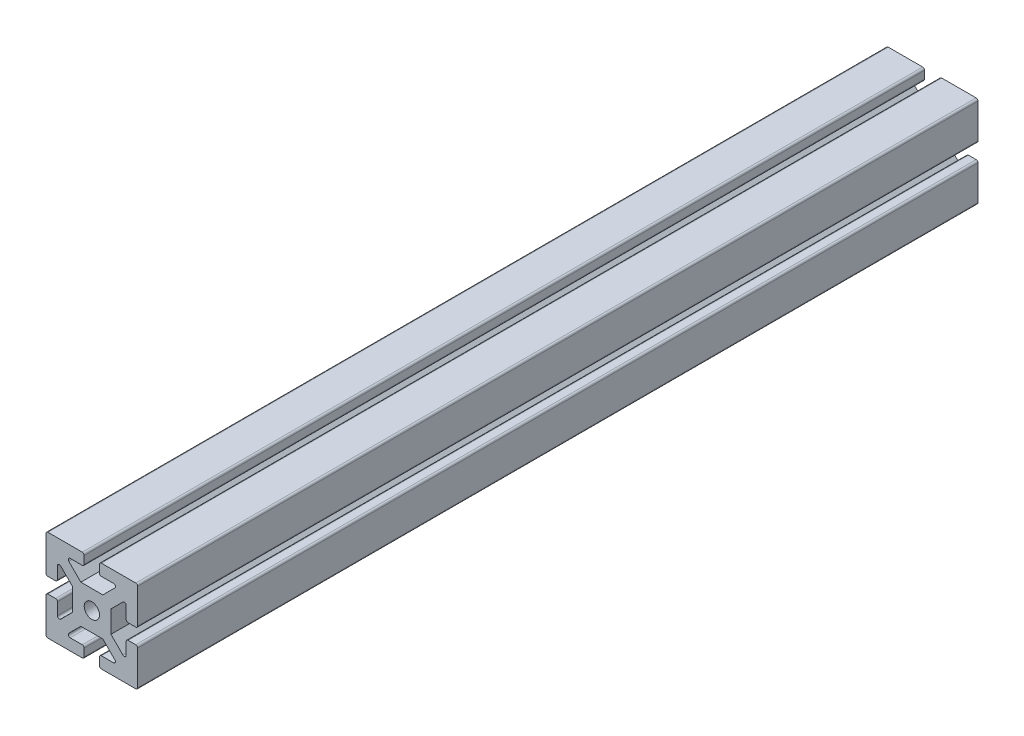
from build123d import *

# Parameters (mm, degrees)
SZKIC1_R                    = 1
DODANIE_WYCI_GNI_CIE1_DEPTH = 110


with BuildPart() as part:
    # Szkic1 → Dodanie-wyciągnięcie1 (new body)
    with BuildSketch(Plane.XY):
        with BuildLine():
            Line((-1.439339828, 2.5), (1.439339828, 2.5))
            Line((1.439339828, 2.5), (3.012563133, 4.073223305))
            ThreePointArc((3.012563133, 4.073223305), (3.066756321, 4.345670858), (2.835786438, 4.5))
            Line((2.835786438, 4.5), (1.25, 4.5))
            ThreePointArc((1.25, 4.5), (1.073223305, 4.573223305), (1, 4.75))
            Line((1, 4.75), (1, 5.75))
            ThreePointArc((1, 5.75), (1.073223305, 5.926776695), (1.25, 6))
            Line((1.25, 6), (5.75, 6))
            ThreePointArc((5.75, 6), (5.926776695, 5.926776695), (6, 5.75))
            Line((6, 5.75), (6, 1.25))
            ThreePointArc((6, 1.25), (5.926776695, 1.073223305), (5.75, 1))
            Line((5.75, 1), (4.75, 1))
            ThreePointArc((4.75, 1), (4.573223305, 1.073223305), (4.5, 1.25))
            Line((4.5, 1.25), (4.5, 2.835786438))
            ThreePointArc((4.5, 2.835786438), (4.345670858, 3.066756321), (4.073223305, 3.012563133))
            Line((4.073223305, 3.012563133), (2.5, 1.439339828))
            Line((2.5, 1.439339828), (2.5, -1.439339828))
            Line((2.5, -1.439339828), (4.073223305, -3.012563133))
            ThreePointArc((4.073223305, -3.012563133), (4.345670858, -3.066756321), (4.5, -2.835786438))
            Line((4.5, -2.835786438), (4.5, -1.25))
            ThreePointArc((4.5, -1.25), (4.573223305, -1.073223305), (4.75, -1))
            Line((4.75, -1), (5.75, -1))
            ThreePointArc((5.75, -1), (5.926776695, -1.073223305), (6, -1.25))
            Line((6, -1.25), (6, -5.75))
            ThreePointArc((6, -5.75), (5.926776695, -5.926776695), (5.75, -6))
            Line((5.75, -6), (1.25, -6))
            ThreePointArc((1.25, -6), (1.073223305, -5.926776695), (1, -5.75))
            Line((1, -5.75), (1, -4.75))
            ThreePointArc((1, -4.75), (1.073223305, -4.573223305), (1.25, -4.5))
            Line((1.25, -4.5), (2.835786438, -4.5))
            ThreePointArc((2.835786438, -4.5), (3.066756321, -4.345670858), (3.012563133, -4.073223305))
            Line((3.012563133, -4.073223305), (1.439339828, -2.5))
            Line((1.439339828, -2.5), (-1.439339828, -2.5))
            Line((-1.439339828, -2.5), (-3.012563133, -4.073223305))
            ThreePointArc((-3.012563133, -4.073223305), (-3.066756321, -4.345670858), (-2.835786438, -4.5))
            Line((-2.835786438, -4.5), (-1.25, -4.5))
            ThreePointArc((-1.25, -4.5), (-1.073223305, -4.573223305), (-1, -4.75))
            Line((-1, -4.75), (-1, -5.75))
            ThreePointArc((-1, -5.75), (-1.073223305, -5.926776695), (-1.25, -6))
            Line((-1.25, -6), (-5.75, -6))
            ThreePointArc((-5.75, -6), (-5.926776695, -5.926776695), (-6, -5.75))
            Line((-6, -5.75), (-6, -1.25))
            ThreePointArc((-6, -1.25), (-5.926776695, -1.073223305), (-5.75, -1))
            Line((-5.75, -1), (-4.75, -1))
            ThreePointArc((-4.75, -1), (-4.573223305, -1.073223305), (-4.5, -1.25))
            Line((-4.5, -1.25), (-4.5, -2.835786438))
            ThreePointArc((-4.5, -2.835786438), (-4.345670858, -3.066756321), (-4.073223305, -3.012563133))
            Line((-4.073223305, -3.012563133), (-2.5, -1.439339828))
            Line((-2.5, -1.439339828), (-2.5, 1.439339828))
            Line((-2.5, 1.439339828), (-4.073223305, 3.012563133))
            ThreePointArc((-4.073223305, 3.012563133), (-4.345670858, 3.066756321), (-4.5, 2.835786438))
            Line((-4.5, 2.835786438), (-4.5, 1.25))
            ThreePointArc((-4.5, 1.25), (-4.573223305, 1.073223305), (-4.75, 1))
            Line((-4.75, 1), (-5.75, 1))
            ThreePointArc((-5.75, 1), (-5.926776695, 1.073223305), (-6, 1.25))
            Line((-6, 1.25), (-6, 5.75))
            ThreePointArc((-6, 5.75), (-5.926776695, 5.926776695), (-5.75, 6))
            Line((-5.75, 6), (-1.25, 6))
            ThreePointArc((-1.25, 6), (-1.073223305, 5.926776695), (-1, 5.75))
            Line((-1, 5.75), (-1, 4.75))
            ThreePointArc((-1, 4.75), (-1.073223305, 4.573223305), (-1.25, 4.5))
            Line((-1.25, 4.5), (-2.835786438, 4.5))
            ThreePointArc((-2.835786438, 4.5), (-3.066756321, 4.345670858), (-3.012563133, 4.073223305))
            Line((-3.012563133, 4.073223305), (-1.439339828, 2.5))
        make_face()
        Circle(SZKIC1_R, mode=Mode.SUBTRACT)
    extrude(amount=-DODANIE_WYCI_GNI_CIE1_DEPTH)


solid = part.part
